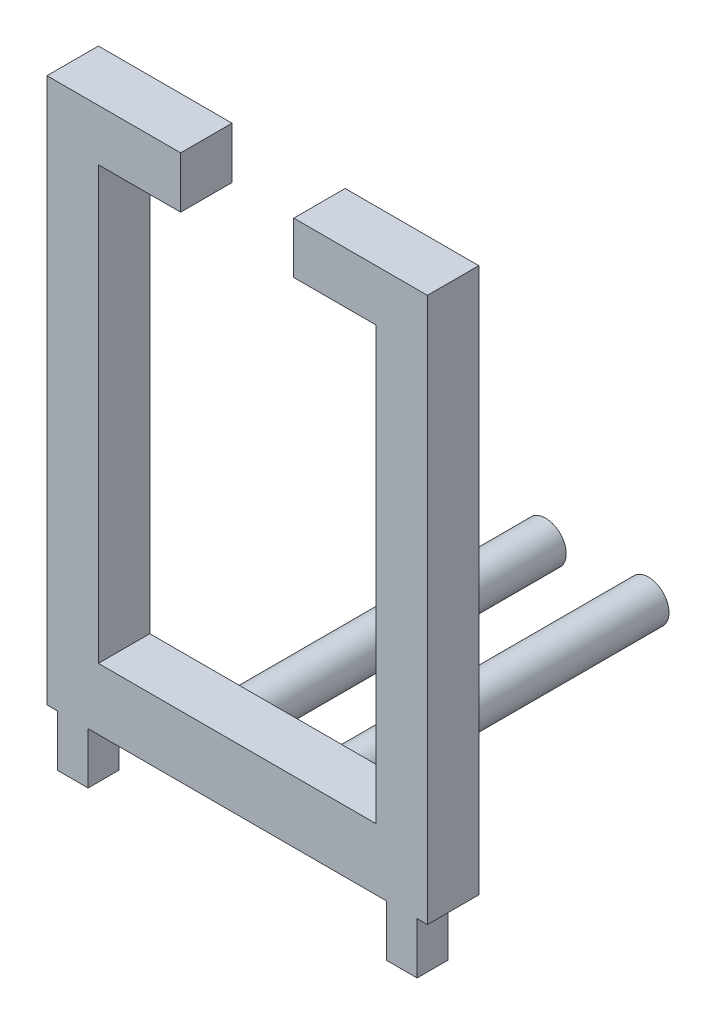
from build123d import *

# Parameters (mm, degrees)
SKETCH_1_W        = 3
SKETCH_1_H        = 3
EXTRUDE_1_DEPTH   = 5
EXTRUDE_1_2_DEPTH = 5
SKETCH_2_W        = 5
SKETCH_2_H        = 5
EXTRUDE_2_DEPTH   = 6
SKETCH_4_W        = 37
SKETCH_4_H        = 5
EXTRUDE_3_DEPTH   = 6
SKETCH_5_R        = 2
EXTRUDE_4_DEPTH   = 30
SKETCH_6_W        = 5
SKETCH_6_H        = 5
EXTRUDE_5_DEPTH   = 47
SKETCH_7_W        = 5
SKETCH_7_H        = 5
EXTRUDE_6_DEPTH   = 8
SKETCH_8_W        = 5
SKETCH_8_H        = 5
EXTRUDE_7_DEPTH   = 8


with BuildPart() as part:
    # 草图1 → 凸台-拉伸1 (new body)
    with BuildSketch(Plane(origin=(0, 0, 0), x_dir=(1, 0, 0), z_dir=(0, 1, 0))):
        with Locations((-301.650432081, -30.158642095)):
            Rectangle(SKETCH_1_W, SKETCH_1_H)
    extrude(amount=EXTRUDE_1_DEPTH)



with BuildPart() as body_2:
    # 草图1 → Extrude 1 2 (new body)
    with BuildSketch(Plane(origin=(0, 0, 0), x_dir=(1, 0, 0), z_dir=(0, 1, 0))):
        with Locations((-269.650432081, -30.158642095)):
            Rectangle(SKETCH_1_W, SKETCH_1_H)
    extrude(amount=EXTRUDE_1_2_DEPTH)


with BuildPart() as part_1:
    add(part.part)

    add(body_2.part)  # 凸台-拉伸2 merges body 2
    # 草图2 → 凸台-拉伸2 (add)
    with BuildSketch(Plane(origin=(0, 5, 0), x_dir=(1, 0, 0), z_dir=(0, 1, 0))):
        with Locations((-301.650432081, -29.158642095)):
            Rectangle(SKETCH_2_W, SKETCH_2_H)
        with Locations((-269.650432081, -29.158642095)):
            Rectangle(SKETCH_2_W, SKETCH_2_H)
    extrude(amount=EXTRUDE_2_DEPTH)

    # 草图4 → 凸台-拉伸3 (add)
    with BuildSketch(Plane(origin=(0, 11, 0), x_dir=(1, 0, 0), z_dir=(0, 1, 0))):
        with Locations((-285.650432081, -29.158642095)):
            Rectangle(SKETCH_4_W, SKETCH_4_H)
    extrude(amount=-EXTRUDE_3_DEPTH)

    # 草图5 → 凸台-拉伸4 (add)
    with BuildSketch(Plane(origin=(0, 0, 26.658642095), x_dir=(-1, 0, 0), z_dir=(0, 0, -1))):
        with Locations(Location((280.65047083, 8.019684887, 0), (0, 0, 180))):
            Circle(SKETCH_5_R)
        with Locations(Location((290.650393331, 7.980315113, 0), (0, 0, 180))):
            Circle(SKETCH_5_R)
    extrude(amount=EXTRUDE_4_DEPTH)

    # 草图6 → 凸台-拉伸5 (add)
    with BuildSketch(Plane(origin=(0, 11, 0), x_dir=(1, 0, 0), z_dir=(0, 1, 0))):
        with Locations((-269.650432081, -29.158642095)):
            Rectangle(SKETCH_6_W, SKETCH_6_H)
        with Locations((-301.650432081, -29.158642095)):
            Rectangle(SKETCH_6_W, SKETCH_6_H)
    extrude(amount=EXTRUDE_5_DEPTH)

    # 草图7 → 凸台-拉伸6 (add)
    with BuildSketch(Plane(origin=(-299.150432081, 0, 0), x_dir=(0, 0, -1), z_dir=(1, 0, 0))):
        with Locations((-29.158642095, 55.5)):
            Rectangle(SKETCH_7_W, SKETCH_7_H)
    extrude(amount=EXTRUDE_6_DEPTH)

    # 草图8 → 凸台-拉伸7 (add)
    with BuildSketch(Plane.ZY.offset(272.150432081)):
        with Locations((29.158642095, 55.5)):
            Rectangle(SKETCH_8_W, SKETCH_8_H)
    extrude(amount=EXTRUDE_7_DEPTH)


solid = part_1.part
